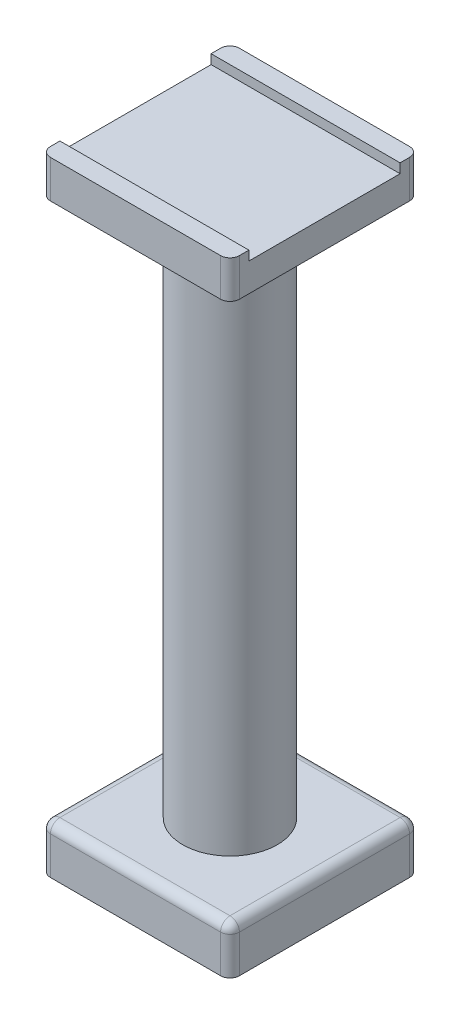
from build123d import *

# Parameters (mm, degrees)
SKETCH_1_W      = 20
SKETCH_1_H      = 20
EXTRUDE_1_DEPTH = 5
SKETCH_2_R      = 5
EXTRUDE_2_DEPTH = 57
SKETCH_4_W      = 20
SKETCH_4_H      = 20
EXTRUDE_3_DEPTH = 3
SKETCH_5_W      = 20
SKETCH_5_H      = 2
EXTRUDE_4_DEPTH = 1
SKETCH_6_W      = 20
SKETCH_6_H      = 2
EXTRUDE_5_DEPTH = 1
FILLET_1_R      = 1
FILLET_2_R      = 1
FILLET_3_R      = 1


with BuildPart() as part:
    # 草图1 → 凸台-拉伸1 (new body)
    with BuildSketch(Plane(origin=(0, 0, 0), x_dir=(1, 0, 0), z_dir=(0, 1, 0))):
        with Locations((-10, 10)):
            Rectangle(SKETCH_1_W, SKETCH_1_H)
    extrude(amount=EXTRUDE_1_DEPTH)

    # 草图2 → 凸台-拉伸2 (add)
    with BuildSketch(Plane(origin=(0, 5, 0), x_dir=(1, 0, 0), z_dir=(0, 1, 0))):
        with Locations(Location((-10, 10, 0), (0, 0, 90))):
            Circle(SKETCH_2_R)
    extrude(amount=EXTRUDE_2_DEPTH)

    # 草图4 → 凸台-拉伸3 (add)
    with BuildSketch(Plane(origin=(0, 62, 0), x_dir=(1, 0, 0), z_dir=(0, 1, 0))):
        with Locations((-10, 10)):
            Rectangle(SKETCH_4_W, SKETCH_4_H)
    extrude(amount=EXTRUDE_3_DEPTH)

    # 草图5 → 凸台-拉伸4 (add)
    with BuildSketch(Plane(origin=(0, 65, 0), x_dir=(1, 0, 0), z_dir=(0, 1, 0))):
        with Locations((-10, 19)):
            Rectangle(SKETCH_5_W, SKETCH_5_H)
    extrude(amount=EXTRUDE_4_DEPTH)

    # 草图6 → 凸台-拉伸5 (add)
    with BuildSketch(Plane(origin=(0, 65, 0), x_dir=(1, 0, 0), z_dir=(0, 1, 0))):
        with Locations((-10, 1)):
            Rectangle(SKETCH_6_W, SKETCH_6_H)
    extrude(amount=EXTRUDE_5_DEPTH)

    # 圆角1
    fillet_1_edges = [part.edges().sort_by_distance(p)[0] for p in [
        (0, 64, 0),
    ]]
    fillet(fillet_1_edges, radius=FILLET_1_R)

    # 圆角2
    fillet_2_edges = [part.edges().sort_by_distance(p)[0] for p in [
        (-20, 64, -20),
        (-20, 64, 0),
        (0, 64, -20),
    ]]
    fillet(fillet_2_edges, radius=FILLET_2_R)

    # 圆角3
    fillet_3_edges = [part.edges().sort_by_distance(p)[0] for p in [
        (-20, 5, -10),
        (-10, 5, 0),
        (0, 5, -10),
        (0, 2.5, 0),
        (-20, 2.5, 0),
        (-20, 2.5, -20),
        (0, 2.5, -20),
        (-10, 5, -20),
    ]]
    fillet(fillet_3_edges, radius=FILLET_3_R)


solid = part.part
